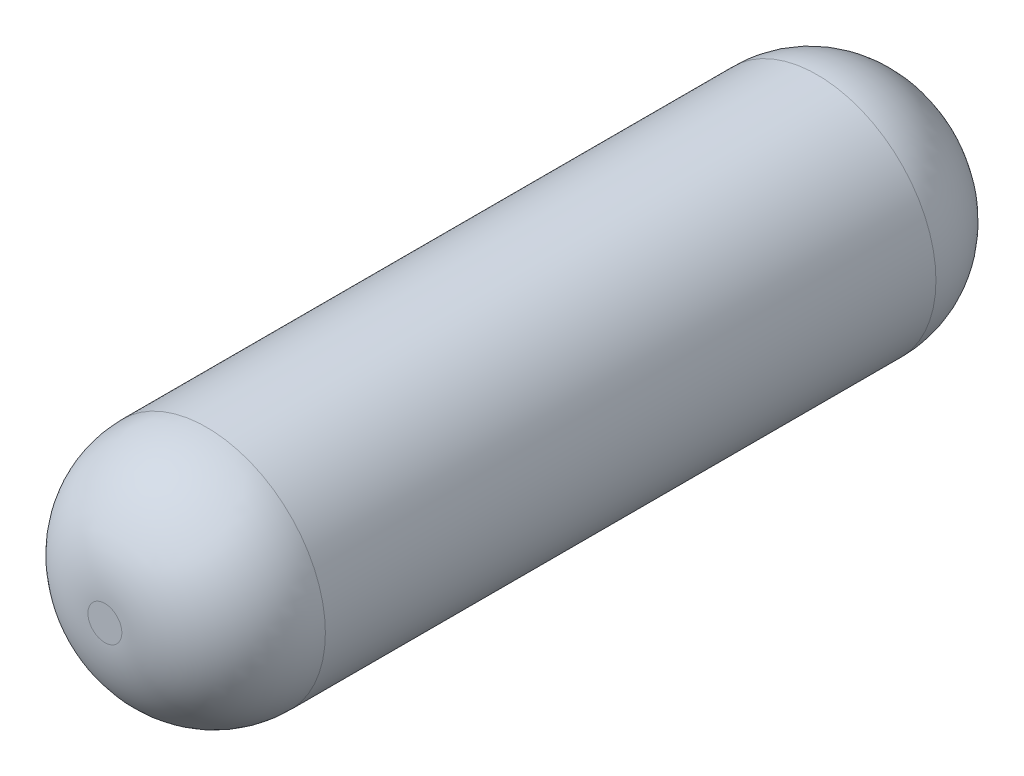
from build123d import *

# Parameters (mm, degrees)
SKETCH1_R           = 35
BOSS_EXTRUDE1_DEPTH = 240
FILLET1_R           = 30


with BuildPart() as part:
    # Sketch1 → Boss-Extrude1 (new body)
    with BuildSketch(Plane.XY):
        Circle(SKETCH1_R)
    extrude(amount=BOSS_EXTRUDE1_DEPTH)

    # Fillet1
    fillet1_edges = [part.edges().sort_by_distance(p)[0] for p in [
        (-35, 0, 0),
        (-35, 0, 240),
    ]]
    fillet(fillet1_edges, radius=FILLET1_R)


solid = part.part
